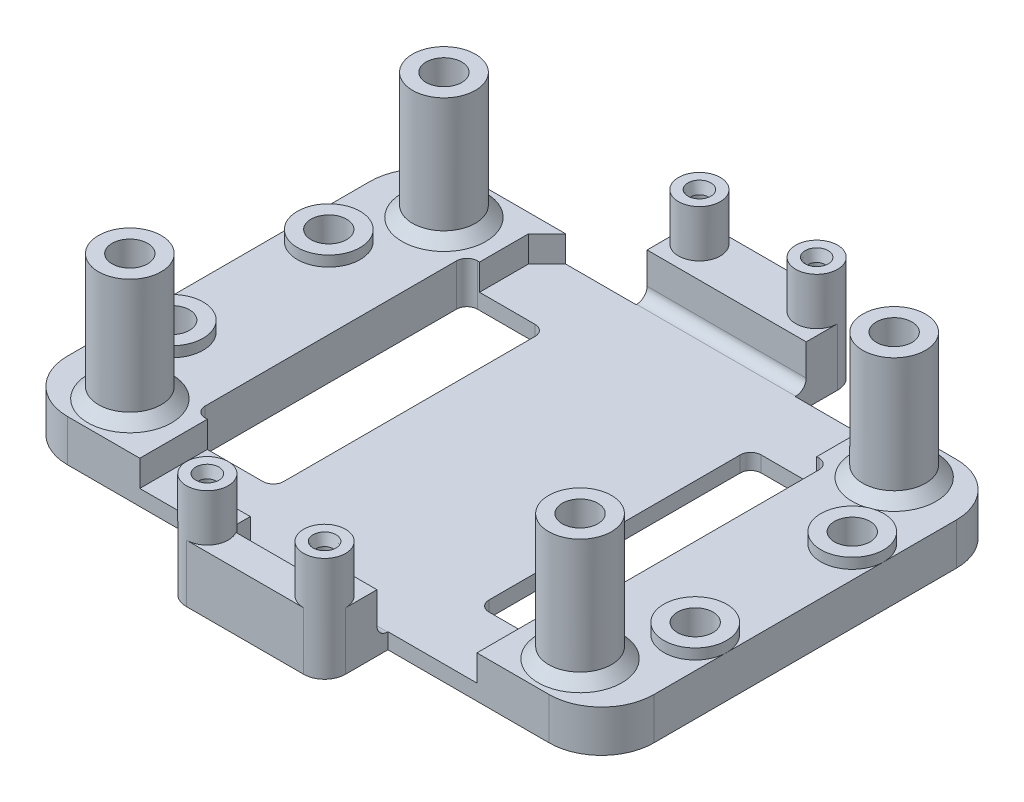
from build123d import *
from OCP.BRepFilletAPI import BRepFilletAPI_MakeChamfer

# Parameters (mm, degrees)
SKETCH2_R               = 3
SKETCH2_R_2             = 1.7
BOSS_EXTRUDE1_DEPTH     = 5
BOSS_EXTRUDE1_2_DEPTH   = 5
BOSS_EXTRUDE1_3_DEPTH   = 5
BOSS_EXTRUDE1_4_DEPTH   = 5
SKETCH3_W               = 56
SKETCH3_H               = 38.9
SKETCH3_R               = 1.7
BOSS_EXTRUDE2_DEPTH     = 4
FILLET1_R               = 5
CUT_EXTRUDE2_START      = 4
CUT_EXTRUDE2_DEPTH      = 2.5
CUT_EXTRUDE3_DEPTH      = 2.5
SKETCH5_R               = 3
SKETCH5_R_2             = 1.7
BOSS_EXTRUDE3_DEPTH     = 12
SKETCH5_2_R             = 1.7
CUT_EXTRUDE4_DEPTH      = 37.14280703
CUT_EXTRUDE5_DEPTH      = 2.5
CHAMFER1_SIZE           = 1
CHAMFER2_SIZE           = 1
CUT_EXTRUDE6_DEPTH      = 38.047975653
CUT_EXTRUDE6_DEPTH_BACK = 38.047975653
SKETCH7_W               = 7.5
SKETCH7_H               = 26
FILLET3_R               = 1
SKETCH8_R               = 2
SKETCH8_R_2             = 0.8
BOSS_EXTRUDE4_DEPTH     = 10
BOSS_EXTRUDE4_2_DEPTH   = 10
BOSS_EXTRUDE4_3_DEPTH   = 10
BOSS_EXTRUDE4_4_DEPTH   = 10
BOSS_EXTRUDE5_DEPTH     = 1.5
BOSS_EXTRUDE7_DEPTH     = 4
FILLET4_R               = 1
CUT_EXTRUDE9_DEPTH      = 42.112650183
CUT_EXTRUDE9_DEPTH_BACK = 42.112650183
SKETCH8_2_R             = 0.8
CHAMFER3_SIZE           = 0.3
CHAMFER3_SIZE2          = 1


with BuildPart() as part:
    # Sketch2 → Boss-Extrude1 (new body)
    with BuildSketch(Plane(origin=(0, 0, 0), x_dir=(1, 0, 0), z_dir=(0, 1, 0))):
        with Locations(Location((-25, 7.5, 0), (0, 0, 270))):
            Circle(SKETCH2_R)
        with Locations(Location((-25, 7.5, 0), (0, 0, 270))):
            Circle(SKETCH2_R_2, mode=Mode.SUBTRACT)
    extrude(amount=BOSS_EXTRUDE1_DEPTH)



with BuildPart() as body_2:
    # Sketch2 → Boss-Extrude1 2 (new body)
    with BuildSketch(Plane(origin=(0, 0, 0), x_dir=(1, 0, 0), z_dir=(0, 1, 0))):
        with Locations(Location((-25, -7.5, 0), (0, 0, 270))):
            Circle(SKETCH2_R)
        with Locations(Location((-25, -7.5, 0), (0, 0, 270))):
            Circle(SKETCH2_R_2, mode=Mode.SUBTRACT)
    extrude(amount=BOSS_EXTRUDE1_2_DEPTH)


with BuildPart() as body_3:
    # Sketch2 → Boss-Extrude1 3 (new body)
    with BuildSketch(Plane(origin=(0, 0, 0), x_dir=(1, 0, 0), z_dir=(0, 1, 0))):
        with Locations(Location((25, -7.5, 0), (0, 0, 270))):
            Circle(SKETCH2_R)
        with Locations(Location((25, -7.5, 0), (0, 0, 270))):
            Circle(SKETCH2_R_2, mode=Mode.SUBTRACT)
    extrude(amount=BOSS_EXTRUDE1_3_DEPTH)


with BuildPart() as body_4:
    # Sketch2 → Boss-Extrude1 4 (new body)
    with BuildSketch(Plane(origin=(0, 0, 0), x_dir=(1, 0, 0), z_dir=(0, 1, 0))):
        with Locations(Location((25, 7.5, 0), (0, 0, 270))):
            Circle(SKETCH2_R)
        with Locations(Location((25, 7.5, 0), (0, 0, 270))):
            Circle(SKETCH2_R_2, mode=Mode.SUBTRACT)
    extrude(amount=BOSS_EXTRUDE1_4_DEPTH)


with BuildPart() as part_1:
    add(part.part)

    add(body_2.part)  # Boss-Extrude2 merges body 2

    add(body_3.part)  # Boss-Extrude2 merges body 3

    add(body_4.part)  # Boss-Extrude2 merges body 4
    # Sketch3 → Boss-Extrude2 (add)
    with BuildSketch(Plane(origin=(0, 0, 0), x_dir=(1, 0, 0), z_dir=(0, 1, 0))):
        Rectangle(SKETCH3_W, SKETCH3_H)
        with Locations(Location((-25, 7.5, 0), (0, 0, 270))):
            Circle(SKETCH3_R, mode=Mode.SUBTRACT)
        with Locations(Location((25, 7.5, 0), (0, 0, 270))):
            Circle(SKETCH3_R, mode=Mode.SUBTRACT)
        with Locations(Location((25, -7.5, 0), (0, 0, 270))):
            Circle(SKETCH3_R, mode=Mode.SUBTRACT)
        with Locations(Location((-25, -7.5, 0), (0, 0, 270))):
            Circle(SKETCH3_R, mode=Mode.SUBTRACT)
    extrude(amount=BOSS_EXTRUDE2_DEPTH)

    # Fillet1
    fillet1_edges = [part_1.edges().sort_by_distance(p)[0] for p in [
        (28, 2, 19.45),
        (28, 2, -19.45),
        (-28, 2, -19.45),
        (-28, 2, 19.45),
    ]]
    fillet(fillet1_edges, radius=FILLET1_R)

    # Sketch1 → Cut-Extrude2 (cut)
    with BuildSketch(Plane(origin=(0, 0, 0), x_dir=(1, 0, 0), z_dir=(0, 1, 0)).offset(CUT_EXTRUDE2_START)):
        Polygon((13.620101013, 19.45), (15.6, 17.470101013), (15.6, -19.45), (-15.6, -19.45), (-15.6, 17.470101013), (-13.620101013, 19.45), align=None)
    extrude(amount=-CUT_EXTRUDE2_DEPTH, mode=Mode.SUBTRACT)

    # Sketch4 → Cut-Extrude3 (cut)
    with BuildSketch(Plane(origin=(0, 4, 0), x_dir=(1, 0, 0), z_dir=(0, 1, 0))):
        Polygon((-16.1, -19.95), (16.1, -19.95), (16.1, 17.677207794), (13.827207794, 19.95), (-13.827207794, 19.95), (-16.1, 17.677207794), align=None)
    extrude(amount=-CUT_EXTRUDE3_DEPTH, mode=Mode.SUBTRACT)

    # Sketch5 → Boss-Extrude3 (add)
    # profile 1 of 4: a face of its own
    with BuildSketch(Plane(origin=(0, 4, 0), x_dir=(1, 0, 0), z_dir=(0, 1, 0))):
        with Locations(Location((-21.5, 15, 0), (0, 0, 90))):
            Circle(SKETCH5_R)
        with Locations(Location((-21.5, 15, 0), (0, 0, 270))):
            Circle(SKETCH5_R_2, mode=Mode.SUBTRACT)
    # profile 2 of 4: a face of its own
    with BuildSketch(Plane(origin=(0, 4, 0), x_dir=(1, 0, 0), z_dir=(0, 1, 0))):
        with Locations(Location((21.5, 15, 0), (0, 0, 90))):
            Circle(SKETCH5_R)
        with Locations(Location((21.5, 15, 0), (0, 0, 270))):
            Circle(SKETCH5_R_2, mode=Mode.SUBTRACT)
    # profile 3 of 4: a face of its own
    with BuildSketch(Plane(origin=(0, 4, 0), x_dir=(1, 0, 0), z_dir=(0, 1, 0))):
        with Locations(Location((21.5, -15, 0), (0, 0, 90))):
            Circle(SKETCH5_R)
        with Locations(Location((21.5, -15, 0), (0, 0, 270))):
            Circle(SKETCH5_R_2, mode=Mode.SUBTRACT)
    # profile 4 of 4: a face of its own
    with BuildSketch(Plane(origin=(0, 4, 0), x_dir=(1, 0, 0), z_dir=(0, 1, 0))):
        with Locations(Location((-21.5, -15, 0), (0, 0, 90))):
            Circle(SKETCH5_R)
        with Locations(Location((-21.5, -15, 0), (0, 0, 270))):
            Circle(SKETCH5_R_2, mode=Mode.SUBTRACT)
    extrude(amount=BOSS_EXTRUDE3_DEPTH)

    # Sketch5<2> → Cut-Extrude4 (cut, through all)
    with BuildSketch(Plane(origin=(0, 4, 0), x_dir=(1, 0, 0), z_dir=(0, 1, 0))):
        with Locations(Location((-21.5, 15, 0), (0, 0, 270))):
            Circle(SKETCH5_2_R)
        with Locations(Location((21.5, 15, 0), (0, 0, 270))):
            Circle(SKETCH5_2_R)
        with Locations(Location((21.5, -15, 0), (0, 0, 270))):
            Circle(SKETCH5_2_R)
        with Locations(Location((-21.5, -15, 0), (0, 0, 270))):
            Circle(SKETCH5_2_R)
    extrude(amount=-CUT_EXTRUDE4_DEPTH, mode=Mode.SUBTRACT)

    # Sketch6 → Cut-Extrude5 (cut)
    with BuildSketch(Plane.XZ):
        Polygon((-19.970021787, 12.35), (-18.440043573, 15), (-19.970021787, 17.65), (-23.029978213, 17.65), (-24.559956427, 15), (-23.029978213, 12.35), align=None)
        Polygon((23.029978213, 12.35), (24.559956427, 15), (23.029978213, 17.65), (19.970021787, 17.65), (18.440043573, 15), (19.970021787, 12.35), align=None)
        Polygon((24.559956427, -15), (23.029978213, -12.35), (19.970021787, -12.35), (18.440043573, -15), (19.970021787, -17.65), (23.029978213, -17.65), align=None)
        Polygon((-18.440043573, -15), (-19.970021787, -12.35), (-23.029978213, -12.35), (-24.559956427, -15), (-23.029978213, -17.65), (-19.970021787, -17.65), align=None)
    extrude(amount=-CUT_EXTRUDE5_DEPTH, mode=Mode.SUBTRACT)

    # Chamfer1
    chamfer1_edges = [part_1.edges().sort_by_distance(p)[0] for p in [
        (-21.5, 4, 18),
    ]]
    chamfer(chamfer1_edges, length=CHAMFER1_SIZE)

    # Chamfer2
    chamfer2_edges = [part_1.edges().sort_by_distance(p)[0] for p in [
        (-21.5, 4, -12),
        (21.5, 4, -12),
        (21.5, 4, 18),
    ]]
    chamfer(chamfer2_edges, length=CHAMFER2_SIZE)

    # Sketch7 → Cut-Extrude6 (cut, two sides: drawn at the far end of the back side and taken through both)
    with BuildSketch(Plane(origin=(0, 1.5, 0), x_dir=(1, 0, 0), z_dir=(0, 1, 0)).offset(-CUT_EXTRUDE6_DEPTH_BACK)):
        with Locations((-13.55, 0)):
            Rectangle(SKETCH7_W, SKETCH7_H)
        with Locations((13.55, 0)):
            Rectangle(SKETCH7_W, SKETCH7_H)
    extrude(amount=CUT_EXTRUDE6_DEPTH + CUT_EXTRUDE6_DEPTH_BACK, mode=Mode.SUBTRACT)

    # Fillet3
    fillet3_edges = [part_1.edges().sort_by_distance(p)[0] for p in [
        (-17.3, 2, 13),
        (-9.8, 0.75, -13),
        (-17.3, 2, -13),
        (-9.8, 0.75, 13),
        (17.3, 2, -13),
        (9.8, 0.75, 13),
        (17.3, 2, 13),
        (9.8, 0.75, -13),
    ]]
    fillet(fillet3_edges, radius=FILLET3_R)



with BuildPart() as body_2_2:
    # Sketch8 → Boss-Extrude4 (new body)
    with BuildSketch(Plane(origin=(0, 0, 0), x_dir=(1, 0, 0), z_dir=(0, 1, 0))):
        with Locations(Location((-5.6, 23.5, 0), (0, 0, 270))):
            Circle(SKETCH8_R)
        with Locations(Location((-5.6, 23.5, 0), (0, 0, 270))):
            Circle(SKETCH8_R_2, mode=Mode.SUBTRACT)
    extrude(amount=BOSS_EXTRUDE4_DEPTH)


with BuildPart() as body_3_2:
    # Sketch8 → Boss-Extrude4 2 (new body)
    with BuildSketch(Plane(origin=(0, 0, 0), x_dir=(1, 0, 0), z_dir=(0, 1, 0))):
        with Locations(Location((5.6, 23.5, 0), (0, 0, 270))):
            Circle(SKETCH8_R)
        with Locations(Location((5.6, 23.5, 0), (0, 0, 270))):
            Circle(SKETCH8_R_2, mode=Mode.SUBTRACT)
    extrude(amount=BOSS_EXTRUDE4_2_DEPTH)


with BuildPart() as body_4_2:
    # Sketch8 → Boss-Extrude4 3 (new body)
    with BuildSketch(Plane(origin=(0, 0, 0), x_dir=(1, 0, 0), z_dir=(0, 1, 0))):
        with Locations(Location((-5.6, -23.5, 0), (0, 0, 270))):
            Circle(SKETCH8_R)
        with Locations(Location((-5.6, -23.5, 0), (0, 0, 270))):
            Circle(SKETCH8_R_2, mode=Mode.SUBTRACT)
    extrude(amount=BOSS_EXTRUDE4_3_DEPTH)


with BuildPart() as body_5:
    # Sketch8 → Boss-Extrude4 4 (new body)
    with BuildSketch(Plane(origin=(0, 0, 0), x_dir=(1, 0, 0), z_dir=(0, 1, 0))):
        with Locations(Location((5.6, -23.5, 0), (0, 0, 270))):
            Circle(SKETCH8_R)
        with Locations(Location((5.6, -23.5, 0), (0, 0, 270))):
            Circle(SKETCH8_R_2, mode=Mode.SUBTRACT)
    extrude(amount=BOSS_EXTRUDE4_4_DEPTH)


with BuildPart() as part_2:
    add(part_1.part)

    add(body_2_2.part)  # Boss-Extrude5 merges body 2 2

    add(body_3_2.part)  # Boss-Extrude5 merges body 3 2

    add(body_4_2.part)  # Boss-Extrude5 merges body 4 2

    add(body_5.part)  # Boss-Extrude5 merges body 5
    # Sketch9 → Boss-Extrude5 (add)
    with BuildSketch(Plane(origin=(0, 0, 0), x_dir=(1, 0, 0), z_dir=(0, 1, 0))):
        with BuildLine():
            Line((-5.6, -25.5), (5.6, -25.5))
            ThreePointArc((5.6, -25.5), (7.014213562, -24.914213562), (7.6, -23.5))
            Line((7.6, -23.5), (7.6, 23.5))
            ThreePointArc((7.6, 23.5), (7.014213562, 24.914213562), (5.6, 25.5))
            Line((5.6, 25.5), (-5.6, 25.5))
            ThreePointArc((-5.6, 25.5), (-7.014213562, 24.914213562), (-7.6, 23.5))
            Line((-7.6, 23.5), (-7.6, -23.5))
            ThreePointArc((-7.6, -23.5), (-7.014213562, -24.914213562), (-5.6, -25.5))
        make_face()
    extrude(amount=BOSS_EXTRUDE5_DEPTH)

    # Sketch10 → Boss-Extrude7 (add)
    with BuildSketch(Plane(origin=(0, 1.5, 0), x_dir=(1, 0, 0), z_dir=(0, 1, 0))):
        with BuildLine():
            Line((7.6, 23.5), (7.6, 20.5))
            Line((7.6, 20.5), (-7.6, 20.5))
            Line((-7.6, 20.5), (-7.6, 23.5))
            ThreePointArc((-7.6, 23.5), (-7.014213562, 24.914213562), (-5.6, 25.5))
            Line((-5.6, 25.5), (5.6, 25.5))
            ThreePointArc((5.6, 25.5), (7.014213562, 24.914213562), (7.6, 23.5))
        make_face()
        with BuildLine():
            Line((-5.6, -25.5), (5.6, -25.5))
            ThreePointArc((5.6, -25.5), (7.014213562, -24.914213562), (7.6, -23.5))
            Line((7.6, -23.5), (7.6, -20.5))
            Line((7.6, -20.5), (4.5, -20.5))
            Line((4.5, -20.5), (4.5, -22.5))
            Line((4.5, -22.5), (-4.5, -22.5))
            Line((-4.5, -22.5), (-4.5, -20.5))
            Line((-4.5, -20.5), (-7.6, -20.5))
            Line((-7.6, -20.5), (-7.6, -23.5))
            ThreePointArc((-7.6, -23.5), (-7.014213562, -24.914213562), (-5.6, -25.5))
        make_face()
    extrude(amount=BOSS_EXTRUDE7_DEPTH)

    # Fillet4
    fillet4_edges = [part_2.edges().sort_by_distance(p)[0] for p in [
        (0, 1.5, -20.5),
        (0, 1.5, 22.5),
        (-6.05, 1.5, 20.5),
        (6.05, 1.5, 20.5),
    ]]
    fillet(fillet4_edges, radius=FILLET4_R)

    # Sketch8<2> → Cut-Extrude9 (cut, two sides: drawn at the far end of the back side and taken through both)
    with BuildSketch(Plane(origin=(0, 0, 0), x_dir=(1, 0, 0), z_dir=(0, 1, 0)).offset(-CUT_EXTRUDE9_DEPTH_BACK)):
        with Locations(Location((-5.6, 23.5, 0), (0, 0, 270))):
            Circle(SKETCH8_2_R)
        with Locations(Location((-5.6, -23.5, 0), (0, 0, 270))):
            Circle(SKETCH8_2_R)
        with Locations(Location((5.6, -23.5, 0), (0, 0, 270))):
            Circle(SKETCH8_2_R)
        with Locations(Location((5.6, 23.5, 0), (0, 0, 270))):
            Circle(SKETCH8_2_R)
    extrude(amount=CUT_EXTRUDE9_DEPTH + CUT_EXTRUDE9_DEPTH_BACK, mode=Mode.SUBTRACT)

    # Chamfer3: one chamfer whose edges measure the first distance from different faces: ONE call of the kernel's chamfer builder (chamfer() names one face for all edges)
    chamfer3_edges_1 = [part_2.edges().sort_by_distance(p)[0] for p in [
        (-5.6, 10, -24.3),
    ]]
    chamfer3_side_1 = [part_2.faces().sort_by_distance(p)[0] for p in [
        (-5.6, 10, -25.443431458),
    ]]
    chamfer3_edges_2 = [part_2.edges().sort_by_distance(p)[0] for p in [
        (5.6, 10, -24.3),
    ]]
    chamfer3_side_2 = [part_2.faces().sort_by_distance(p)[0] for p in [
        (5.6, 10, -25.443431458),
    ]]
    chamfer3_edges_3 = [part_2.edges().sort_by_distance(p)[0] for p in [
        (-5.6, 10, 22.7),
    ]]
    chamfer3_side_3 = [part_2.faces().sort_by_distance(p)[0] for p in [
        (-5.6, 10, 21.556568542),
    ]]
    chamfer3_edges_4 = [part_2.edges().sort_by_distance(p)[0] for p in [
        (5.6, 10, 22.7),
    ]]
    chamfer3_side_4 = [part_2.faces().sort_by_distance(p)[0] for p in [
        (5.6, 10, 21.556568542),
    ]]
    chamfer3 = BRepFilletAPI_MakeChamfer(part_2.part.solid().wrapped)
    for e in chamfer3_edges_1:
        chamfer3.Add(CHAMFER3_SIZE, CHAMFER3_SIZE2, e.wrapped, chamfer3_side_1[0].wrapped)  # the first distance lies on this face
    for e in chamfer3_edges_2:
        chamfer3.Add(CHAMFER3_SIZE, CHAMFER3_SIZE2, e.wrapped, chamfer3_side_2[0].wrapped)  # the first distance lies on this face
    for e in chamfer3_edges_3:
        chamfer3.Add(CHAMFER3_SIZE, CHAMFER3_SIZE2, e.wrapped, chamfer3_side_3[0].wrapped)  # the first distance lies on this face
    for e in chamfer3_edges_4:
        chamfer3.Add(CHAMFER3_SIZE, CHAMFER3_SIZE2, e.wrapped, chamfer3_side_4[0].wrapped)  # the first distance lies on this face
    add(Compound.cast(chamfer3.Shape()), mode=Mode.REPLACE)


solid = part_2.part
